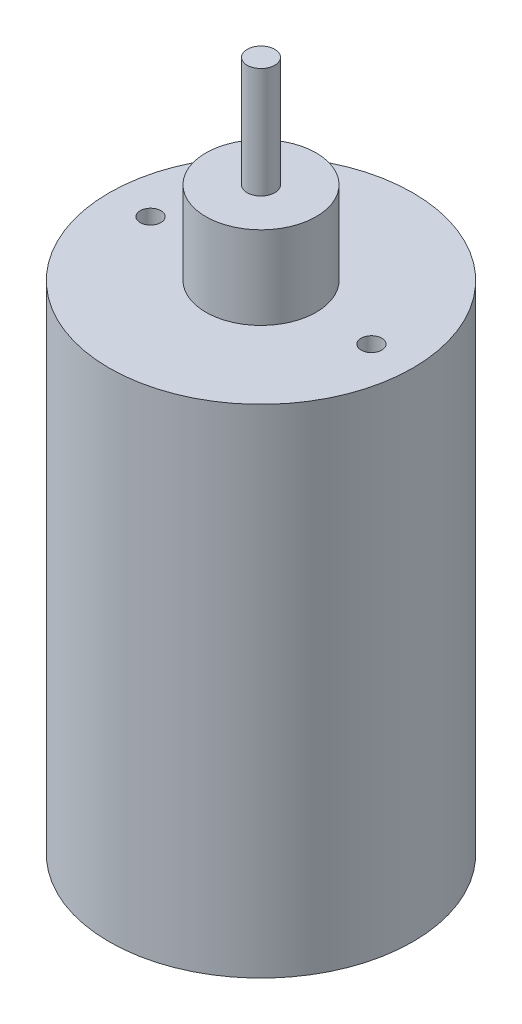
from build123d import *

# Parameters (mm, degrees)
SKETCH1_R           = 17.4625
BOSS_EXTRUDE1_DEPTH = 57.15
SKETCH2_R           = 6.35
BOSS_EXTRUDE2_DEPTH = 9.525
SKETCH3_R           = 1.5875
BOSS_EXTRUDE3_DEPTH = 12.7
SKETCH4_R           = 1.190625
CUT_EXTRUDE1_DEPTH  = 12.7


with BuildPart() as part:
    # Sketch1 → Boss-Extrude1 (new body)
    with BuildSketch(Plane(origin=(0, 0, 0), x_dir=(1, 0, 0), z_dir=(0, 1, 0))):
        with Locations(Location((0, 0, 0), (0, 0, 270))):
            Circle(SKETCH1_R)
    extrude(amount=BOSS_EXTRUDE1_DEPTH)

    # Sketch2 → Boss-Extrude2 (add)
    with BuildSketch(Plane(origin=(0, 57.15, 0), x_dir=(1, 0, 0), z_dir=(0, 1, 0))):
        with Locations(Location((0, 0, 0), (0, 0, 90))):
            Circle(SKETCH2_R)
    extrude(amount=BOSS_EXTRUDE2_DEPTH)

    # Sketch3 → Boss-Extrude3 (add)
    with BuildSketch(Plane(origin=(0, 66.675, 0), x_dir=(1, 0, 0), z_dir=(0, 1, 0))):
        with Locations(Location((0, 0, 0), (0, 0, 270))):
            Circle(SKETCH3_R)
    extrude(amount=BOSS_EXTRUDE3_DEPTH)

    # Sketch4 → Cut-Extrude1 (cut)
    with BuildSketch(Plane(origin=(0, 57.15, 0), x_dir=(1, 0, 0), z_dir=(0, 1, 0))):
        with Locations(Location((12.7, 0, 0), (0, 0, 270))):
            Circle(SKETCH4_R)
        with Locations(Location((-12.7, 0, 0), (0, 0, 270))):
            Circle(SKETCH4_R)
    extrude(amount=-CUT_EXTRUDE1_DEPTH, mode=Mode.SUBTRACT)


solid = part.part
